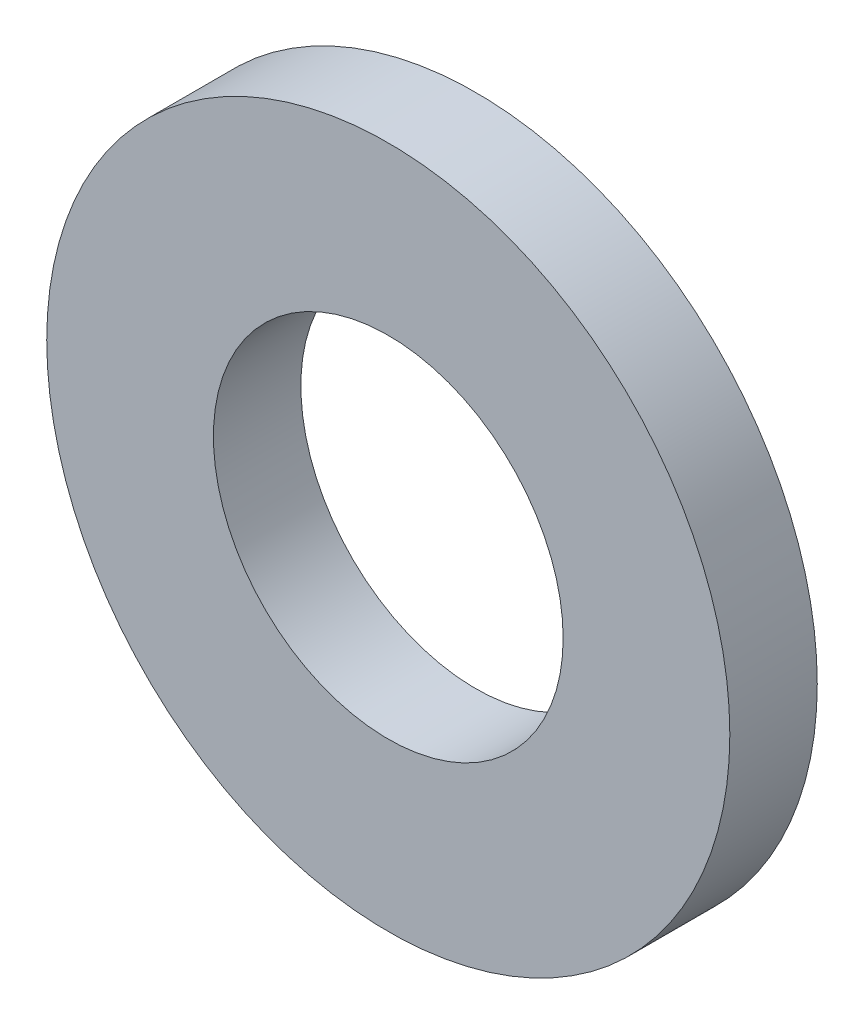
from build123d import *

# Parameters (mm, degrees)
SKETCH1_R           = 6.25
SKETCH1_R_2         = 3.2
BOSS_EXTRUDE1_DEPTH = 0.8


with BuildPart() as part:
    # Sketch1 → Boss-Extrude1 (new, symmetric)
    with BuildSketch(Plane.XY):
        Circle(SKETCH1_R)
        Circle(SKETCH1_R_2, mode=Mode.SUBTRACT)
    extrude(amount=BOSS_EXTRUDE1_DEPTH, both=True)


solid = part.part
